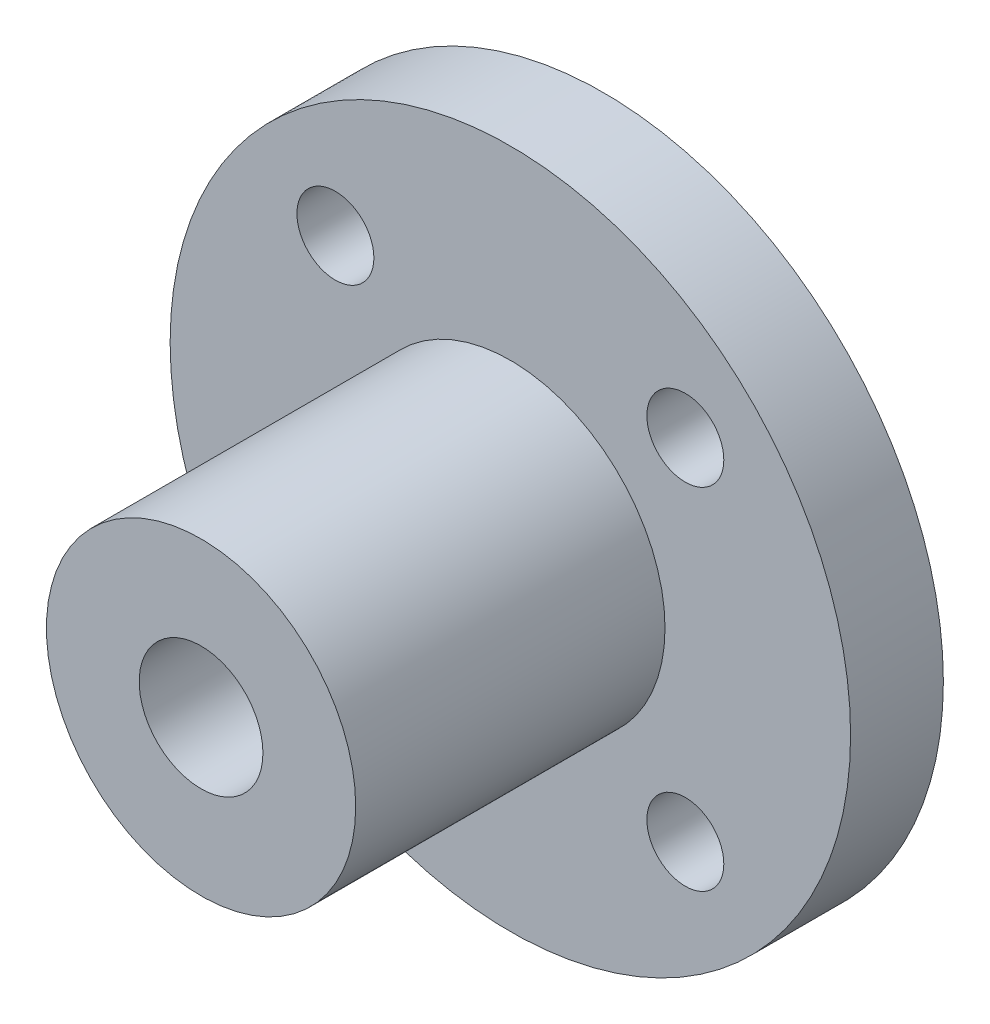
from build123d import *

# Parameters (mm, degrees)
SKETCH2_R               = 11
SKETCH2_R_2             = 2
SKETCH2_R_3             = 1.244152151
BOSS_EXTRUDE1_DEPTH     = 3
SKETCH3_R               = 5
SKETCH3_R_2             = 2
BOSS_EXTRUDE3_DEPTH     = 10
CUT_EXTRUDE2_REACH      = 22.273
CUT_EXTRUDE2_END_RADIUS = 5
SKETCH6_R               = 1.5


with BuildPart() as part:
    # Sketch2 → Boss-Extrude1 (new body)
    with BuildSketch(Plane.XY):
        Circle(SKETCH2_R)
        Circle(SKETCH2_R_2, mode=Mode.SUBTRACT)
        with Locations((-5.656854249, 5.656854249)):
            Circle(SKETCH2_R_3, mode=Mode.SUBTRACT)
        with Locations((5.656854249, 5.656854249)):
            Circle(SKETCH2_R_3, mode=Mode.SUBTRACT)
        with Locations((5.656854249, -5.656854249)):
            Circle(SKETCH2_R_3, mode=Mode.SUBTRACT)
        with Locations((-5.656854249, -5.656854249)):
            Circle(SKETCH2_R_3, mode=Mode.SUBTRACT)
    extrude(amount=BOSS_EXTRUDE1_DEPTH)

    # Sketch3 → Boss-Extrude3 (add)
    with BuildSketch(Plane.XY.offset(3)):
        Circle(SKETCH3_R)
        Circle(SKETCH3_R_2, mode=Mode.SUBTRACT)
    extrude(amount=BOSS_EXTRUDE3_DEPTH)

    # Cut-Extrude2: up to this cylinder (the profile starts inside it)
    cut_extrude2_end = Plane(origin=(0, 0, 8), z_dir=(0, 0, -1)) * Cylinder(CUT_EXTRUDE2_END_RADIUS, 55.546, mode=Mode.PRIVATE)
    # Sketch6 → Cut-Extrude2 (cut, up to the surface)
    with BuildSketch(Plane(origin=(0, 0, 0), x_dir=(1, 0, 0), z_dir=(0, 1, 0)), mode=Mode.PRIVATE) as cut_extrude2_sk1:
        with Locations(Location((0, -8, 0), (0, 0, 270))):
            Circle(SKETCH6_R)
    cut_extrude2_tool1 = extrude(cut_extrude2_sk1.sketch, amount=-CUT_EXTRUDE2_REACH, mode=Mode.PRIVATE) & cut_extrude2_end
    add(cut_extrude2_tool1.solids().sort_by_distance((0, 0, 8))[0], mode=Mode.SUBTRACT)


solid = part.part
